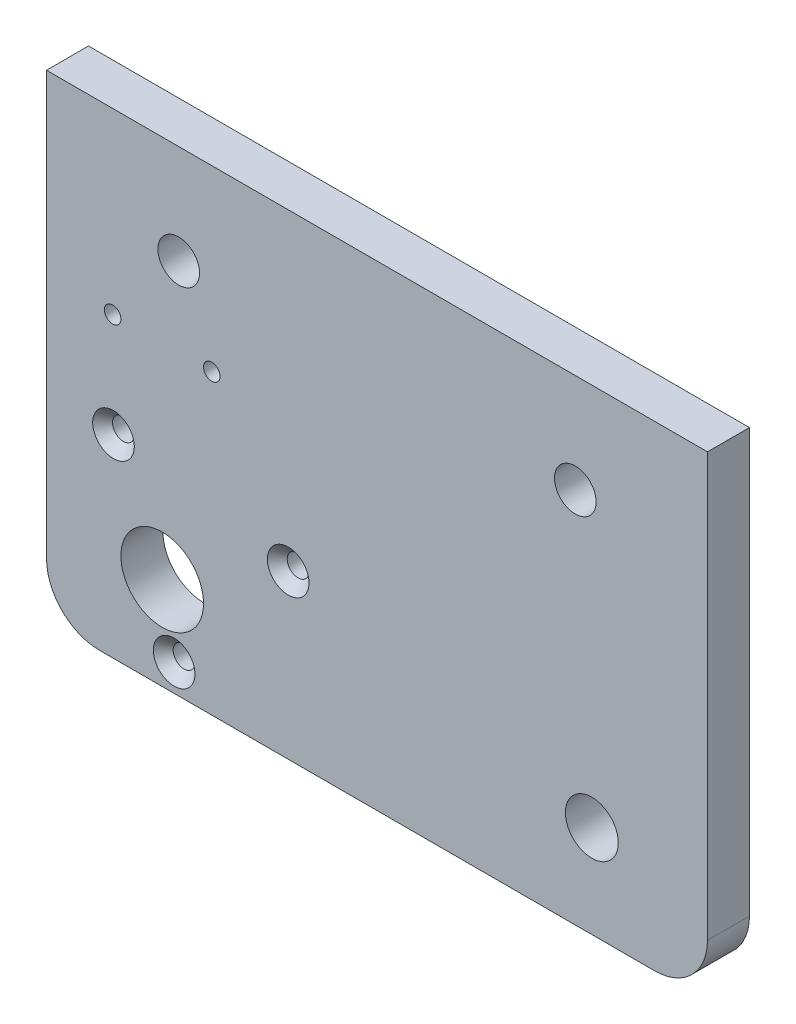
from build123d import *

# Parameters (mm, degrees)
SKETCH2_W           = 100
SKETCH2_H           = 72
BOSS_EXTRUDE1_DEPTH = 6.35
FILLET1_R           = 8
SKETCH4_R           = 6.25
SKETCH4_R_2         = 4
SKETCH4_R_3         = 3.15
SKETCH4_R_4         = 1.25
CUT_EXTRUDE9_DEPTH  = 124.386881393
SKETCH5_R           = 1.65
CUT_EXTRUDE11_DEPTH = 124.386881393
CHAMFER1_SIZE       = 1.5


with BuildPart() as part:
    # Sketch2 → Boss-Extrude1 (new body)
    with BuildSketch(Plane.XY):
        with Locations((50, 36)):
            Rectangle(SKETCH2_W, SKETCH2_H)
    extrude(amount=BOSS_EXTRUDE1_DEPTH)

    # Fillet1
    fillet1_edges = [part.edges().sort_by_distance(p)[0] for p in [
        (100, 0, 3.175),
        (0, 0, 3.175),
    ]]
    fillet(fillet1_edges, radius=FILLET1_R)

    # Sketch4 → Cut-Extrude9 (cut, through all)
    with BuildSketch(Plane.XY):
        with Locations((17.5, 14)):
            Circle(SKETCH4_R)
        with Locations((82.5, 14)):
            Circle(SKETCH4_R_2)
        with Locations((20, 57)):
            Circle(SKETCH4_R_3)
        with Locations((80, 57)):
            Circle(SKETCH4_R_3)
        with Locations((10, 45)):
            Circle(SKETCH4_R_4)
        with Locations((25, 45)):
            Circle(SKETCH4_R_4)
    extrude(amount=CUT_EXTRUDE9_DEPTH, mode=Mode.SUBTRACT)

    # Sketch5 → Cut-Extrude11 (cut, through all)
    with BuildSketch(Plane.XY.offset(6.35)):
        with Locations((10.126311132, 29.325110598)):
            Circle(SKETCH5_R)
        with Locations((36.565235622, 24.663214869)):
            Circle(SKETCH5_R)
        with Locations((19.308453246, 4.097382476)):
            Circle(SKETCH5_R)
    extrude(amount=-CUT_EXTRUDE11_DEPTH, mode=Mode.SUBTRACT)

    # Chamfer1
    chamfer1_edges = [part.edges().sort_by_distance(p)[0] for p in [
        (17.658453246, 4.097382476, 6.35),
        (34.915235622, 24.663214869, 6.35),
        (8.476311132, 29.325110598, 6.35),
        (17.658453246, 4.097382476, 0),
        (8.476311132, 29.325110598, 0),
        (34.915235622, 24.663214869, 0),
    ]]
    chamfer(chamfer1_edges, length=CHAMFER1_SIZE)


solid = part.part
